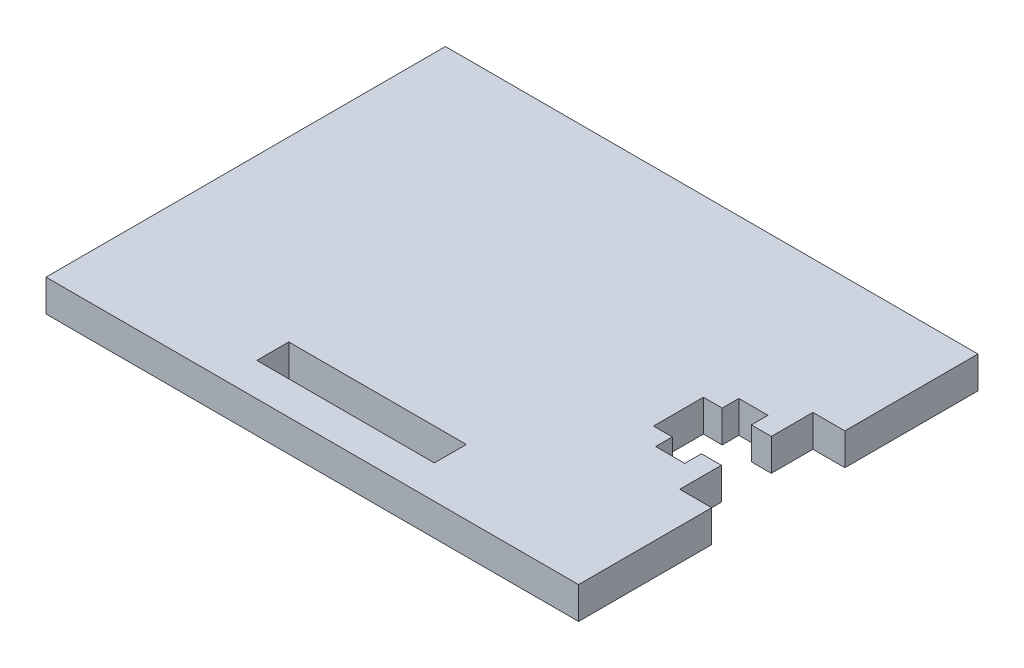
from build123d import *

# Parameters (mm, degrees)
SKETCH2_W           = 16.933333418
SKETCH2_H           = 3.048
BOSS_EXTRUDE1_DEPTH = 3.048


with BuildPart() as part:
    # Sketch2 → Boss-Extrude1 (new body)
    with BuildSketch(Plane(origin=(0, 0, 0), x_dir=(1, 0, 0), z_dir=(0, 1, 0))):
        Polygon((47.752, 25.4), (50.8, 25.4), (50.8, 38.1), (0, 38.1), (0, 0), (50.8, 0), (50.8, 12.7), (47.752, 12.7), (47.752, 16.66875), (45.847, 16.66875), (45.847, 15.08125), (43.068875, 15.08125), (43.068875, 16.66875), (41.275, 16.66875), (41.275, 21.43125), (43.068875, 21.43125), (43.068875, 23.01875), (45.847, 23.01875), (45.847, 21.43125), (47.752, 21.43125), align=None)
        with Locations((25.400000042, 4.699)):
            Rectangle(SKETCH2_W, SKETCH2_H, mode=Mode.SUBTRACT)
    extrude(amount=BOSS_EXTRUDE1_DEPTH)


solid = part.part
